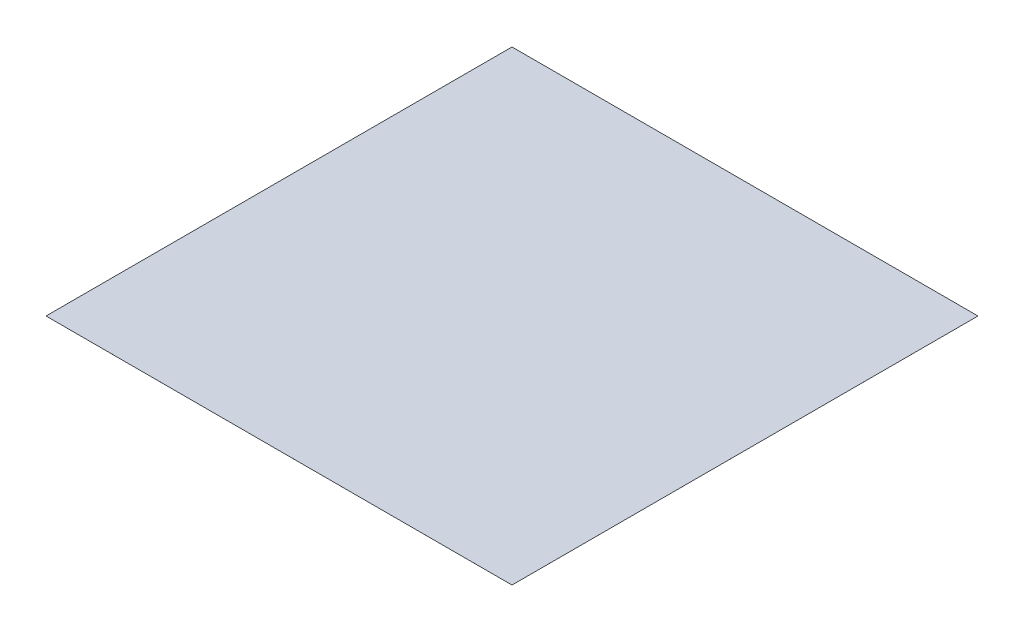
from build123d import *

# Parameters (mm, degrees)
BOSS_EXTRU_2_DEPTH      = 5000
BOSS_EXTRU_2_DEPTH_BACK = 5000
ESQUISSE1_W             = 10000
ESQUISSE1_H             = 0.05


with BuildPart() as part:
    # Esquisse1 → Boss.-Extru.2 (new, two sides: drawn at the far end of the back side and taken through both)
    with BuildSketch(Plane.XY.offset(-BOSS_EXTRU_2_DEPTH_BACK)):
        Rectangle(ESQUISSE1_W, ESQUISSE1_H)
    extrude(amount=BOSS_EXTRU_2_DEPTH + BOSS_EXTRU_2_DEPTH_BACK)


solid = part.part
